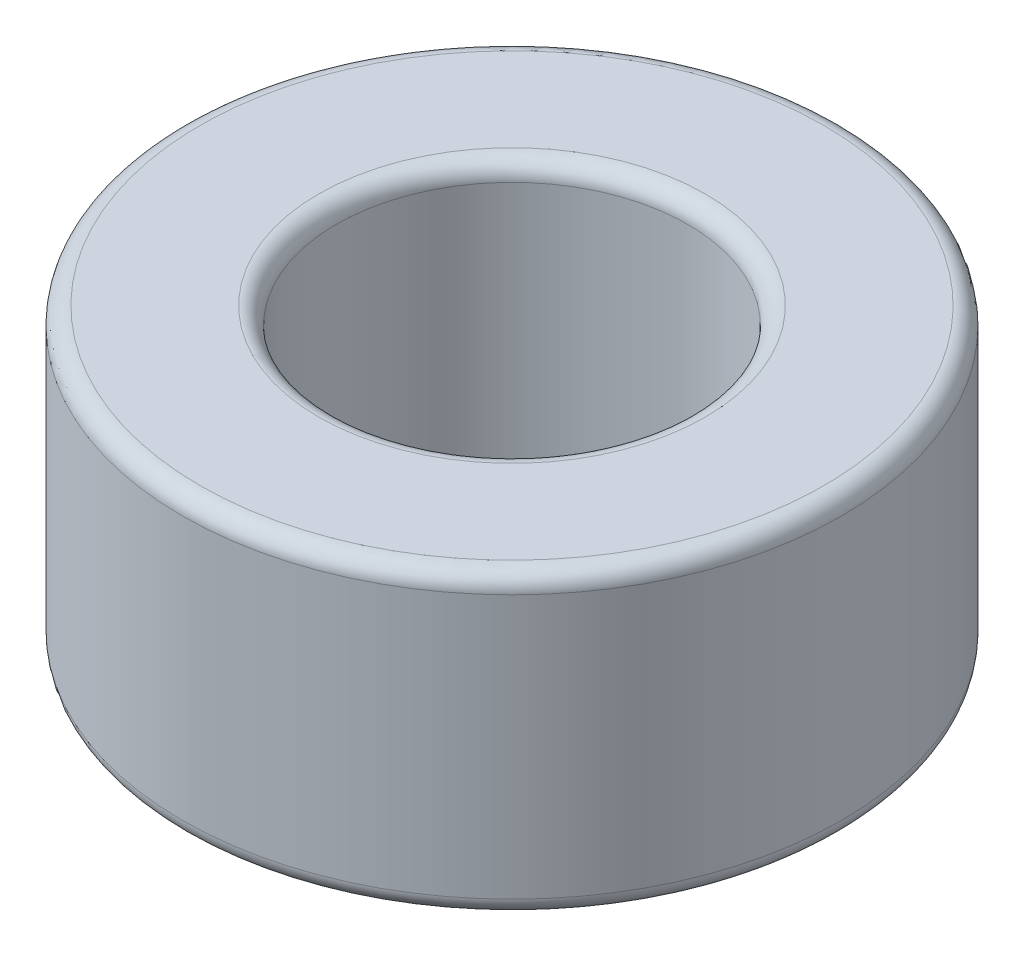
from build123d import *

# Parameters (mm, degrees)
SKETCH1_R           = 9.525
SKETCH1_R_2         = 5.08
BOSS_EXTRUDE1_DEPTH = 8.636
FILLET1_R           = 0.508


with BuildPart() as part:
    # Sketch1 → Boss-Extrude1 (new body)
    with BuildSketch(Plane(origin=(0, 0, 0), x_dir=(1, 0, 0), z_dir=(0, 1, 0))):
        with Locations(Location((0, 0, 0), (0, 0, 270))):
            Circle(SKETCH1_R)
        with Locations(Location((0, 0, 0), (0, 0, 270))):
            Circle(SKETCH1_R_2, mode=Mode.SUBTRACT)
    extrude(amount=BOSS_EXTRUDE1_DEPTH)

    # Fillet1
    fillet1_edges = [part.edges().sort_by_distance(p)[0] for p in [
        (0, 0, -9.525),
        (0, 8.636, -9.525),
        (0, 0, -5.08),
        (0, 8.636, -5.08),
    ]]
    fillet(fillet1_edges, radius=FILLET1_R)


solid = part.part
